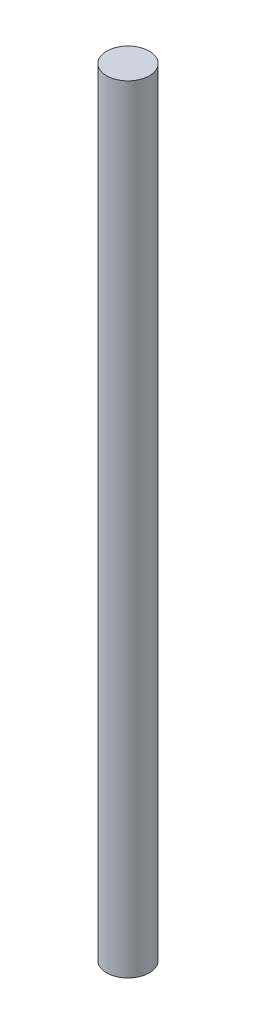
from build123d import *

# Parameters (mm, degrees)
SKETCH1_R           = 11
BOSS_EXTRUDE1_DEPTH = 400


with BuildPart() as part:
    # Sketch1 → Boss-Extrude1 (new body)
    with BuildSketch(Plane(origin=(0, 0, 0), x_dir=(1, 0, 0), z_dir=(0, 1, 0))):
        with Locations(Location((0, 0, 0), (0, 0, 270))):
            Circle(SKETCH1_R)
    extrude(amount=BOSS_EXTRUDE1_DEPTH)


solid = part.part
